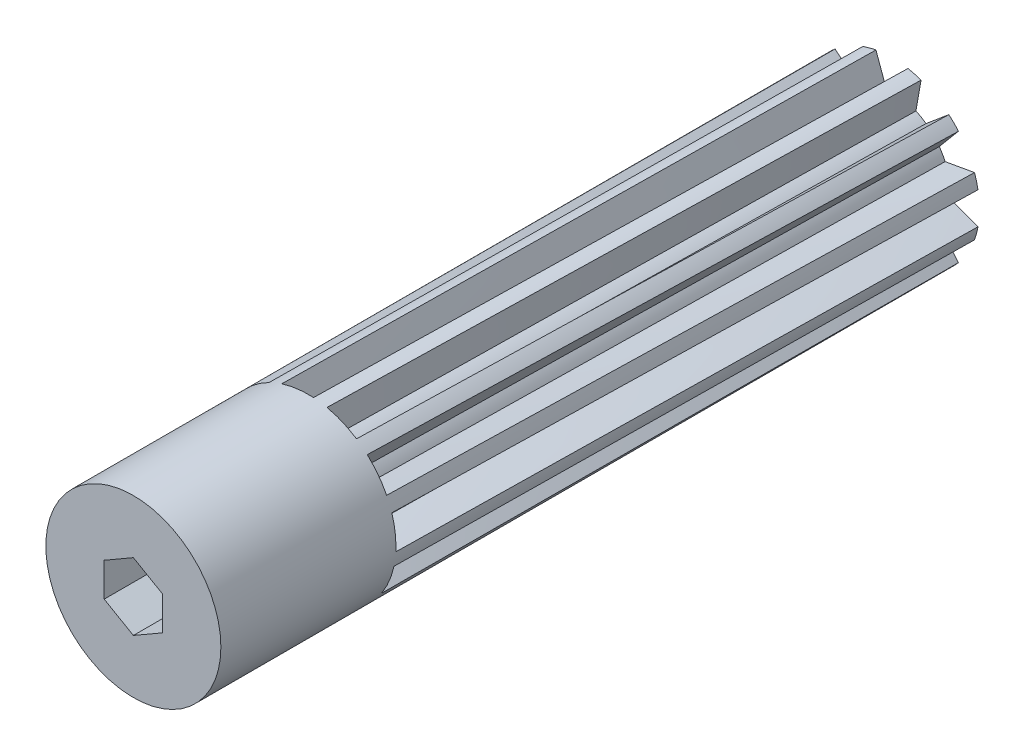
from build123d import *

# Parameters (mm, degrees)
SKETCH1_R              = 15
BOSS_EXTRUDE2_DEPTH    = 130
CUT_EXTRUDE1_DEPTH     = 132.719398723
CUT_SWEEP1_PITCH       = 5000
CUT_SWEEP1_HEIGHT      = 100
CUT_SWEEP1_RADIUS      = 15
CUT_SWEEP1_START_ANGLE = 90
CIRPATTERN2_COUNT      = 12


with BuildPart() as part:
    # Sketch1 → Boss-Extrude2 (new body)
    with BuildSketch(Plane.XY):
        Circle(SKETCH1_R)
    extrude(amount=-BOSS_EXTRUDE2_DEPTH)

    # Sketch1<4> → Cut-Extrude1 (cut, through all)
    with BuildSketch(Plane.XY):
        Polygon((5, 2.886751346), (0, 5.773502692), (-5, 2.886751346), (-5, -2.886751346), (0, -5.773502692), (5, -2.886751346), align=None)
    extrude(amount=-CUT_EXTRUDE1_DEPTH, mode=Mode.SUBTRACT)

    # Cut-Sweep1: sweep along a helix
    with BuildLine() as cut_sweep1_path:
        add(Helix(CUT_SWEEP1_PITCH, CUT_SWEEP1_HEIGHT, CUT_SWEEP1_RADIUS, center=(0, 0, -130), direction=(0, 0, 1), mode=Mode.PRIVATE).rotate(Axis((0, 0, -130), (0, 0, 1)), CUT_SWEEP1_START_ANGLE))
    # Sketch6 → Cut-Sweep1 (sweep, cut)
    with BuildSketch(Plane.XY.offset(-130)):
        with BuildLine():
            Line((-2.745842373, 14.74653687), (-1, 9.949874371))
            ThreePointArc((-1, 9.949874371), (0, 10), (1, 9.949874371))
            Line((1, 9.949874371), (2.745842373, 14.74653687))
            ThreePointArc((2.745842373, 14.74653687), (0, 15), (-2.745842373, 14.74653687))
        make_face()
    cut_sweep1 = sweep(path=cut_sweep1_path.line, is_frenet=True, mode=Mode.SUBTRACT)

    # CirPattern2: Cut-Sweep1 ×12 about axis
    cirpattern2_axis = Axis((0, 0, -130), (0, 0, 1))
    for i in range(1, CIRPATTERN2_COUNT):
        add(cut_sweep1.rotate(cirpattern2_axis, i * 360 / CIRPATTERN2_COUNT), mode=Mode.SUBTRACT)


solid = part.part
